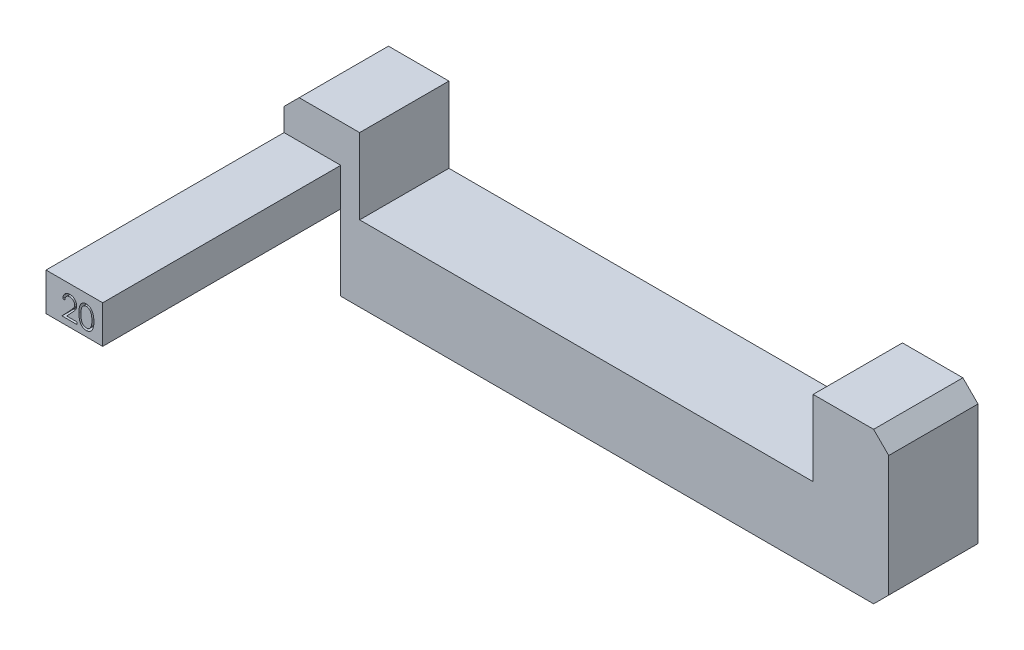
from build123d import *

# Parameters (mm, degrees)
BOSS_EXTRUDE1_DEPTH = 15
SKETCH2_W           = 9.525
SKETCH2_H           = 6.35
BOSS_EXTRUDE2_DEPTH = 40
CUT_EXTRUDE1_DEPTH  = 2
CHAMFER1_SIZE       = 2.54
SKETCH4_W           = 9.525
SKETCH4_H           = 12.7
CUT_EXTRUDE2_DEPTH  = 113.105842971


with BuildPart() as part:
    # Sketch1 → Boss-Extrude1 (new body)
    with BuildSketch(Plane.XY):
        Polygon((-101.6, 0), (0, 0), (0, 25.4), (-12.7, 25.4), (-12.7, 12.7), (-88.9, 12.7), (-88.9, 25.4), (-101.6, 25.4), align=None)
    extrude(amount=BOSS_EXTRUDE1_DEPTH)

    # Sketch2 → Boss-Extrude2 (add)
    with BuildSketch(Plane.XY.offset(15)):
        with Locations((-96.8375, 15.875)):
            Rectangle(SKETCH2_W, SKETCH2_H)
    extrude(amount=BOSS_EXTRUDE2_DEPTH)

    # Sketch3 → Cut-Extrude1 (cut)
    # profile 1 of 2: a face of its own
    with BuildSketch(Plane.XY.offset(55)):
        with BuildLine():
            Line((-98.442638889, 16.280423077), (-98.775064103, 16.280423077))
            add(Edge.make_bspline(
                [(-98.775064103, 16.280423077), (-98.772897532, 16.324524766), (-98.768642446, 16.411139311), (-98.74871584, 16.537423779), (-98.720203411, 16.658131774), (-98.679889956, 16.7722941), (-98.629824145, 16.880920171), (-98.569784866, 16.983578521), (-98.498671375, 17.079877529), (-98.418019248, 17.168924471), (-98.330422438, 17.25061465), (-98.235906985, 17.321158115), (-98.136587665, 17.380760984), (-98.032765801, 17.430588632), (-97.923270038, 17.467989969), (-97.809094013, 17.495741204), (-97.689736094, 17.512437837), (-97.608413737, 17.514232543), (-97.567054621, 17.515145299)],
                knots=[0, 0, 0, 0, 1.10065271, 2.161652631, 3.183658789, 4.190468796, 5.17591951, 6.163126047, 7.15150782, 8.156236427, 9.156009102, 10.134482811, 11.092018607, 12.041330605, 13.001268258, 13.972401359, 14.968799086, 16, 16, 16, 16], degree=3))
            add(Edge.make_bspline(
                [(-97.567054621, 17.515145299), (-97.526437826, 17.514194433), (-97.446627274, 17.512326014), (-97.330144976, 17.496280592), (-97.219255672, 17.47114984), (-97.114176119, 17.435891025), (-97.015744701, 17.388494173), (-96.923221979, 17.331558444), (-96.835506454, 17.265709123), (-96.756547608, 17.18818217), (-96.684043224, 17.10541798), (-96.621493338, 17.017059948), (-96.56792774, 16.925800621), (-96.523279112, 16.830944108), (-96.490411365, 16.731597269), (-96.465457761, 16.62920648), (-96.451352915, 16.522711888), (-96.449188175, 16.45063245), (-96.448087607, 16.413986779)],
                knots=[0, 0, 0, 0, 1.111607364, 2.184268762, 3.212621178, 4.221274766, 5.211760367, 6.196651075, 7.1921475, 8.207485113, 9.220403448, 10.201281604, 11.166441695, 12.114753415, 13.065576456, 14.026450734, 14.996634279, 16, 16, 16, 16], degree=3))
            add(Edge.make_bspline(
                [(-96.448087607, 16.413986779), (-96.449879643, 16.362395321), (-96.453432269, 16.260117761), (-96.483821651, 16.109818698), (-96.531284208, 15.964198996), (-96.588431411, 15.847002018), (-96.646081414, 15.752563237), (-96.69803236, 15.674808858), (-96.758849285, 15.591088904), (-96.829417362, 15.501683722), (-96.908276818, 15.405893014), (-96.996141941, 15.303774647), (-97.093639293, 15.196383691), (-97.162069539, 15.123035263), (-97.197528379, 15.085027945)],
                knots=[0, 0, 0, 0, 1.184426356, 2.348067706, 3.509069118, 4.696110526, 5.333549288, 6.050745305, 6.844228056, 7.710549037, 8.667450064, 9.695053472, 10.805634456, 12, 12, 12, 12], degree=3))
            Line((-97.197528379, 15.085027945), (-98.124312066, 14.09591453))
            Line((-98.124312066, 14.09591453), (-96.400598291, 14.09591453))
            Line((-96.400598291, 14.09591453), (-96.400598291, 13.716))
            Line((-96.400598291, 13.716), (-98.917532051, 13.716))
            Line((-98.917532051, 13.716), (-97.480980235, 15.24901449))
            add(Edge.make_bspline(
                [(-97.480980235, 15.24901449), (-97.446004555, 15.285525198), (-97.378823431, 15.355654795), (-97.283803537, 15.458041095), (-97.198460608, 15.553026025), (-97.122242201, 15.640430122), (-97.056801741, 15.721531865), (-96.998728629, 15.793704593), (-96.952198378, 15.860119719), (-96.901699584, 15.937103536), (-96.852789788, 16.031096572), (-96.810760877, 16.145961393), (-96.785133496, 16.264206068), (-96.782059212, 16.344112391), (-96.780512821, 16.384305956)],
                knots=[0, 0, 0, 0, 1.329631726, 2.553950428, 3.673215718, 4.687767853, 5.603093632, 6.413772471, 7.123043292, 7.734684054, 8.834405432, 9.900288307, 10.943827018, 12, 12, 12, 12], degree=3))
            add(Edge.make_bspline(
                [(-96.780512821, 16.384305956), (-96.781185648, 16.409580436), (-96.782511661, 16.459391583), (-96.794214391, 16.532422678), (-96.811899677, 16.602870439), (-96.837241741, 16.670951561), (-96.870692208, 16.735981543), (-96.911409868, 16.798039543), (-96.958389352, 16.858035364), (-97.012736112, 16.914289271), (-97.072438304, 16.965810214), (-97.135508885, 17.011449871), (-97.202236912, 17.049591263), (-97.272341041, 17.080858131), (-97.34562583, 17.105385409), (-97.422233018, 17.122380739), (-97.501950935, 17.133051368), (-97.556384718, 17.134495117), (-97.584121094, 17.135230769)],
                knots=[0, 0, 0, 0, 0.991446411, 1.95395049, 2.89581595, 3.838931463, 4.798493298, 5.75982156, 6.748411868, 7.785213223, 8.824556874, 9.840280684, 10.836137867, 11.835679398, 12.848801643, 13.863922112, 14.911575587, 16, 16, 16, 16], degree=3))
            add(Edge.make_bspline(
                [(-97.584121094, 17.135230769), (-97.613088558, 17.134474027), (-97.669975876, 17.132987909), (-97.753498519, 17.122592257), (-97.833175967, 17.104657909), (-97.909208648, 17.080129262), (-97.981725209, 17.048952298), (-98.050372989, 17.010120201), (-98.114997881, 16.963782671), (-98.175721368, 16.911246416), (-98.231669079, 16.852754871), (-98.280825356, 16.787550993), (-98.323776771, 16.716825312), (-98.361251543, 16.640768663), (-98.391684648, 16.558690912), (-98.414939566, 16.470883425), (-98.433340645, 16.377727463), (-98.439487996, 16.313396581), (-98.442638889, 16.280423077)],
                knots=[0, 0, 0, 0, 1.031018746, 2.02475058, 2.990194455, 3.934040569, 4.864654155, 5.795059489, 6.735614925, 7.690564532, 8.649604399, 9.611025574, 10.590972636, 11.591080095, 12.624614302, 13.701020113, 14.821632451, 16, 16, 16, 16], degree=3))
        make_face()
    # profile 2 of 2: a face of its own
    with BuildSketch(Plane.XY.offset(55)):
        with BuildLine():
            add(Edge.make_bspline(
                [(-96.068173077, 15.566599292), (-96.067825924, 15.625969028), (-96.067151576, 15.741295594), (-96.059649663, 15.909342674), (-96.047187426, 16.066992313), (-96.030108706, 16.214252058), (-96.009325177, 16.351159925), (-95.981580454, 16.477350043), (-95.950028571, 16.59340646), (-95.913460566, 16.699707628), (-95.872198489, 16.797685697), (-95.827288897, 16.889152369), (-95.776949489, 16.973969247), (-95.724057257, 17.053490075), (-95.666471147, 17.126413152), (-95.605829928, 17.193768303), (-95.539766775, 17.253998848), (-95.470527425, 17.308869518), (-95.397485, 17.356970208), (-95.322721512, 17.39933819), (-95.245722358, 17.43553305), (-95.166277314, 17.463992094), (-95.085100441, 17.487498574), (-95.001907962, 17.503573543), (-94.916562518, 17.513687938), (-94.858955916, 17.514654903), (-94.829740752, 17.515145299)],
                knots=[0, 0, 0, 0, 1.646270934, 3.197905019, 4.663502075, 6.030701355, 7.308322542, 8.50163776, 9.611534131, 10.641858119, 11.616356847, 12.558055219, 13.465016945, 14.349605745, 15.204443733, 16.039544428, 16.859896111, 17.680448484, 18.487036065, 19.28249412, 20.06191084, 20.843045899, 21.620316918, 22.403196591, 23.190181807, 24, 24, 24, 24], degree=3))
            add(Edge.make_bspline(
                [(-94.829740752, 17.515145299), (-94.800281537, 17.514629028), (-94.741696428, 17.513602327), (-94.655082031, 17.503734488), (-94.570468617, 17.487360883), (-94.488216921, 17.464161185), (-94.40765131, 17.435379094), (-94.329401945, 17.399303561), (-94.252982784, 17.357310093), (-94.17960823, 17.30796649), (-94.108472762, 17.252951914), (-94.041323667, 17.190761423), (-93.978154835, 17.12202297), (-93.91817347, 17.047471998), (-93.863081296, 16.965678616), (-93.810616081, 16.878065433), (-93.763655676, 16.783100268), (-93.718428145, 16.682367606), (-93.679389417, 16.573080234), (-93.644182641, 16.455854196), (-93.615735732, 16.329304848), (-93.592040419, 16.194096155), (-93.573683738, 16.049731569), (-93.560314191, 15.896520551), (-93.553251843, 15.734362305), (-93.551921834, 15.623493581), (-93.551239316, 15.566599292)],
                knots=[0, 0, 0, 0, 0.810914788, 1.612654377, 2.396697861, 3.181598691, 3.963628158, 4.749916497, 5.551656086, 6.361998678, 7.18212741, 8.025565596, 8.878627764, 9.750805457, 10.657531673, 11.591944965, 12.560506719, 13.57287815, 14.630710178, 15.753379473, 16.941251878, 18.199788006, 19.531962791, 20.947069417, 22.433333509, 24, 24, 24, 24], degree=3))
            add(Edge.make_bspline(
                [(-93.551239316, 15.566599292), (-93.55192891, 15.509953156), (-93.553272555, 15.399580471), (-93.56023502, 15.238151855), (-93.573949571, 15.085753926), (-93.591105142, 14.942021186), (-93.614865744, 14.807551873), (-93.644081212, 14.681880665), (-93.67651947, 14.564464856), (-93.716561294, 14.456266347), (-93.760387629, 14.355775774), (-93.808071045, 14.261936375), (-93.859156611, 14.173918715), (-93.914813033, 14.092427316), (-93.974136229, 14.016884904), (-94.038395888, 13.94862492), (-94.105780591, 13.886002626), (-94.177125398, 13.830279654), (-94.251644289, 13.781506569), (-94.327800979, 13.737888577), (-94.406946727, 13.702717308), (-94.487287935, 13.672517723), (-94.569973789, 13.649445578), (-94.654901219, 13.633492414), (-94.741638235, 13.622303875), (-94.800271559, 13.62145035), (-94.829740752, 13.621021368)],
                knots=[0, 0, 0, 0, 1.561518951, 3.042555995, 4.452378317, 5.7783523, 7.031515105, 8.214008947, 9.334062868, 10.386615937, 11.391082383, 12.354592575, 13.286541444, 14.194233754, 15.072674879, 15.931287219, 16.775624067, 17.606195743, 18.42308326, 19.229000347, 20.022332153, 20.807536673, 21.593273796, 22.3848459, 23.188221202, 24, 24, 24, 24], degree=3))
            add(Edge.make_bspline(
                [(-94.829740752, 13.621021368), (-94.858955106, 13.621514927), (-94.91656011, 13.62248813), (-95.00191726, 13.632556829), (-95.084766179, 13.64874457), (-95.165515694, 13.671410476), (-95.244580089, 13.699154511), (-95.320881992, 13.735300493), (-95.395269791, 13.776929049), (-95.467545021, 13.824337537), (-95.536349558, 13.878652985), (-95.602070582, 13.938728524), (-95.663057061, 14.006063301), (-95.719819812, 14.079594103), (-95.773767388, 14.158644451), (-95.823391975, 14.244293646), (-95.869292796, 14.336202075), (-95.911248823, 14.434963531), (-95.948447826, 14.542019163), (-95.98130665, 14.65859371), (-96.0072508, 14.785716091), (-96.029457761, 14.922365305), (-96.0473694, 15.069128548), (-96.059597727, 15.226085497), (-96.067155619, 15.393138343), (-96.067827735, 15.507723854), (-96.068173077, 15.566599292)],
                knots=[0, 0, 0, 0, 0.810891512, 1.598919785, 2.382837074, 3.152667961, 3.926044502, 4.706494248, 5.493654104, 6.291793342, 7.103789334, 7.925228297, 8.761435821, 9.622817696, 10.50288917, 11.416980706, 12.369136599, 13.353924996, 14.394355917, 15.514179734, 16.714354668, 17.994756427, 19.357759367, 20.818452758, 22.365282078, 24, 24, 24, 24], degree=3))
        make_face()
        with BuildLine():
            add(Edge.make_bspline(
                [(-95.735747863, 15.568083333), (-95.735621448, 15.518607627), (-95.735376102, 15.422584996), (-95.728966623, 15.283050878), (-95.720235128, 15.15290728), (-95.708973088, 15.031988954), (-95.692248301, 14.920705191), (-95.673508617, 14.81829061), (-95.650703556, 14.725287201), (-95.623721328, 14.641056768), (-95.592988284, 14.564169837), (-95.559432912, 14.492625217), (-95.523385313, 14.425577751), (-95.483042546, 14.363629683), (-95.43910577, 14.306578992), (-95.392567405, 14.253415911), (-95.341690586, 14.206005773), (-95.271307459, 14.149144851), (-95.178389523, 14.090387101), (-95.061316208, 14.039220823), (-94.941017098, 14.007066057), (-94.859365358, 14.002976915), (-94.818610443, 14.000935897)],
                knots=[0, 0, 0, 0, 1.459021318, 2.831673884, 4.118529203, 5.306027144, 6.411944654, 7.436330062, 8.375795394, 9.233974572, 10.042671642, 10.816086306, 11.563610507, 12.285937304, 12.993564865, 13.685989202, 14.367179055, 15.041617293, 16.353048772, 17.594441528, 18.799311195, 20, 20, 20, 20], degree=3))
            add(Edge.make_bspline(
                [(-94.818610443, 14.000935897), (-94.777591908, 14.002626882), (-94.695639524, 14.00600536), (-94.575906257, 14.038600691), (-94.459669221, 14.087780953), (-94.368576418, 14.14593373), (-94.299274059, 14.201314545), (-94.249620245, 14.248531715), (-94.204046244, 14.301401674), (-94.160821714, 14.358445096), (-94.121177526, 14.420751808), (-94.085127372, 14.4880222), (-94.052230829, 14.56044308), (-94.033488756, 14.610999387), (-94.023906417, 14.636847523)],
                knots=[0, 0, 0, 0, 1.353760809, 2.704726607, 4.075137775, 5.516104923, 6.260822281, 7.007110065, 7.778089737, 8.566572457, 9.372053459, 10.217411131, 11.088608312, 12, 12, 12, 12], degree=3))
            add(Edge.make_bspline(
                [(-94.023906417, 14.636847523), (-94.012739129, 14.669898997), (-93.990064746, 14.737007664), (-93.960842285, 14.841109196), (-93.937828404, 14.950332121), (-93.917123842, 15.064023703), (-93.902991858, 15.183022387), (-93.891617089, 15.306959976), (-93.884917112, 15.435929918), (-93.884086584, 15.523554617), (-93.88366453, 15.568083333)],
                knots=[0, 0, 0, 0, 0.884706709, 1.796334032, 2.740027952, 3.714592787, 4.726048262, 5.777819803, 6.87074269, 8, 8, 8, 8], degree=3))
            add(Edge.make_bspline(
                [(-93.88366453, 15.568083333), (-93.884246814, 15.612604848), (-93.885385885, 15.699698447), (-93.889739855, 15.827246855), (-93.900983138, 15.948391902), (-93.913470539, 16.063655485), (-93.931882598, 16.172399556), (-93.95173461, 16.275534462), (-93.978405893, 16.371782497), (-94.006895988, 16.462650554), (-94.039503657, 16.547106247), (-94.075397809, 16.625543337), (-94.113732504, 16.698340504), (-94.155369708, 16.765298017), (-94.199815139, 16.826715792), (-94.248241879, 16.881362405), (-94.298729007, 16.930931529), (-94.369443862, 16.987512748), (-94.462020819, 17.045204293), (-94.577215795, 17.098296388), (-94.697093894, 17.128785165), (-94.778134133, 17.133083784), (-94.818610443, 17.135230769)],
                knots=[0, 0, 0, 0, 1.31362396, 2.569729283, 3.763502607, 4.902122613, 5.988968491, 7.01645872, 7.998833611, 8.933434873, 9.825090667, 10.667526885, 11.477055099, 12.250526234, 12.991942729, 13.710640831, 14.402115721, 15.076753259, 16.378508321, 17.609869233, 18.806226677, 20, 20, 20, 20], degree=3))
            add(Edge.make_bspline(
                [(-94.818610443, 17.135230769), (-94.859579153, 17.133080822), (-94.941591208, 17.128777009), (-95.062715294, 17.098409983), (-95.178819066, 17.045479594), (-95.271151214, 16.987321666), (-95.341915388, 16.931930287), (-95.391744572, 16.883896289), (-95.438465938, 16.831354004), (-95.48150592, 16.773778644), (-95.521817078, 16.711902797), (-95.55883865, 16.645239687), (-95.592194491, 16.573451493), (-95.622975625, 16.496599099), (-95.650040159, 16.412375933), (-95.672364603, 16.319487082), (-95.692988401, 16.217398246), (-95.707588394, 16.105511767), (-95.720567535, 15.984563155), (-95.728908629, 15.854094659), (-95.735397543, 15.714326523), (-95.735628751, 15.617807414), (-95.735747863, 15.568083333)],
                knots=[0, 0, 0, 0, 1.207732386, 2.417664972, 3.655092373, 4.956220595, 5.625982001, 6.301752483, 6.994047911, 7.697131622, 8.419323945, 9.170223765, 9.943494443, 10.752040957, 11.610060368, 12.549350801, 13.567764191, 14.679664412, 15.874934091, 17.154273443, 18.533957287, 20, 20, 20, 20], degree=3))
        make_face(mode=Mode.SUBTRACT)
    extrude(amount=-CUT_EXTRUDE1_DEPTH, mode=Mode.SUBTRACT)

    # Chamfer1
    chamfer1_edges = [part.edges().sort_by_distance(p)[0] for p in [
        (0, 25.4, 7.5),
        (0, 0, 7.5),
        (-101.6, 0, 7.5),
        (-101.6, 25.4, 7.5),
    ]]
    chamfer(chamfer1_edges, length=CHAMFER1_SIZE)

    # Sketch4 → Cut-Extrude2 (cut, through all)
    with BuildSketch(Plane.XY.offset(15)):
        with Locations((-96.8375, 6.35)):
            Rectangle(SKETCH4_W, SKETCH4_H)
    extrude(amount=-CUT_EXTRUDE2_DEPTH, mode=Mode.SUBTRACT)


solid = part.part
